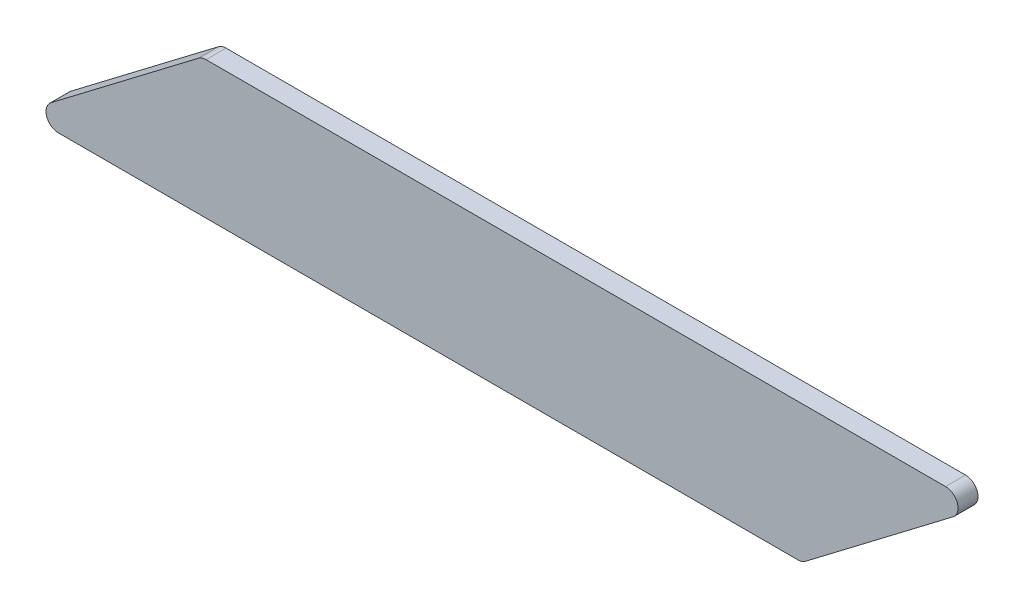
from build123d import *

# Parameters (mm, degrees)
SKETCH1_W               = 77
SKETCH1_H               = 11
BOSS_EXTRUDE1_DEPTH     = 1.6
CUT_EXTRUDE1_DEPTH      = 39.923771657
CUT_EXTRUDE1_DEPTH_BACK = 10
FILLET2_R               = 1


with BuildPart() as part:
    # Sketch1 → Boss-Extrude1 (new body)
    with BuildSketch(Plane.XY):
        Rectangle(SKETCH1_W, SKETCH1_H)
    extrude(amount=BOSS_EXTRUDE1_DEPTH)

    # Sketch2 → Cut-Extrude1 (cut, two sides: drawn at the far end of the back side and taken through both)
    with BuildSketch(Plane.XY.offset(1.6).offset(-CUT_EXTRUDE1_DEPTH_BACK)):
        Polygon((38.5, -5.5), (38.5, 5.5), (24.04554885, -5.5), align=None)
        Polygon((-38.5, -5.5), (-24.04554885, 5.5), (-38.5, 5.5), align=None)
    extrude(amount=CUT_EXTRUDE1_DEPTH + CUT_EXTRUDE1_DEPTH_BACK, mode=Mode.SUBTRACT)

    # Fillet2
    fillet2_edges = [part.edges().sort_by_distance(p)[0] for p in [
        (24.04554885, -5.5, 0.8),
        (-24.04554885, 5.5, 0.8),
        (-38.5, -5.5, 0.8),
        (38.5, 5.5, 0.8),
    ]]
    fillet(fillet2_edges, radius=FILLET2_R)


solid = part.part
